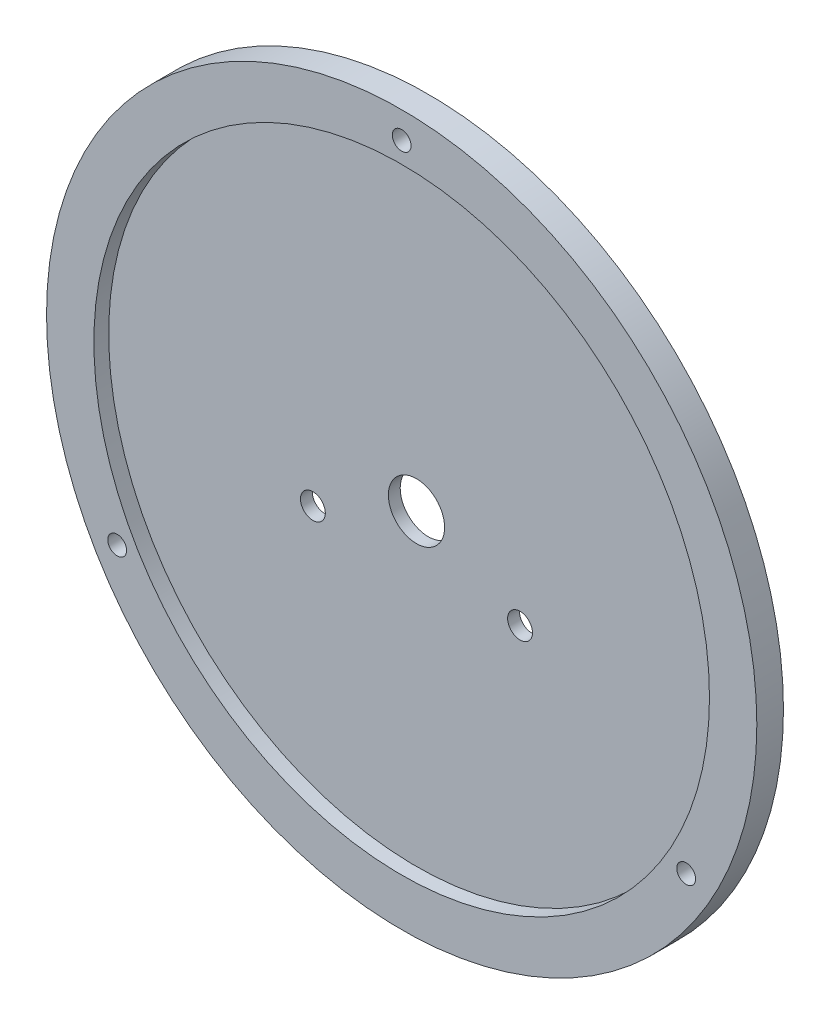
from build123d import *

# Parameters (mm, degrees)
CROQUIS1_R              = 60
SALIENTE_EXTRUIR1_DEPTH = 2
CROQUIS2_R              = 60
CROQUIS2_R_2            = 52
SALIENTE_EXTRUIR2_DEPTH = 2.5
CROQUIS3_R              = 1.5875
CORTAR_EXTRUIR1_DEPTH   = 85.97205423
CROQUIS4_R              = 4.75
CORTAR_EXTRUIR2_DEPTH   = 85.97205423
CROQUIS5_R              = 2.1
CORTAR_EXTRUIR3_DEPTH   = 85.97205423


with BuildPart() as part:
    # Croquis1 → Saliente-Extruir1 (new body)
    with BuildSketch(Plane.XY):
        Circle(CROQUIS1_R)
    extrude(amount=SALIENTE_EXTRUIR1_DEPTH)

    # Croquis2 → Saliente-Extruir2 (add)
    with BuildSketch(Plane.XY.offset(2)):
        Circle(CROQUIS2_R)
        Circle(CROQUIS2_R_2, mode=Mode.SUBTRACT)
    extrude(amount=SALIENTE_EXTRUIR2_DEPTH)

    # Croquis3 → Cortar-Extruir1 (cut, through all)
    with BuildSketch(Plane.XY.offset(4.5)):
        with Locations((0, 55.5)):
            Circle(CROQUIS3_R)
        with Locations((48.06440991, -27.75)):
            Circle(CROQUIS3_R)
        with Locations((-48.06440991, -27.75)):
            Circle(CROQUIS3_R)
    extrude(amount=-CORTAR_EXTRUIR1_DEPTH, mode=Mode.SUBTRACT)

    # Croquis4 → Cortar-Extruir2 (cut, through all)
    with BuildSketch(Plane(origin=(0, 0, 0), x_dir=(-1, 0, 0), z_dir=(0, 0, -1))):
        Circle(CROQUIS4_R)
    extrude(amount=-CORTAR_EXTRUIR2_DEPTH, mode=Mode.SUBTRACT)

    # Croquis5 → Cortar-Extruir3 (cut, through all)
    with BuildSketch(Plane(origin=(0, 0, 0), x_dir=(-1, 0, 0), z_dir=(0, 0, -1))):
        with Locations((-17.5, -8)):
            Circle(CROQUIS5_R)
        with Locations((17.5, -8)):
            Circle(CROQUIS5_R)
    extrude(amount=-CORTAR_EXTRUIR3_DEPTH, mode=Mode.SUBTRACT)


solid = part.part
